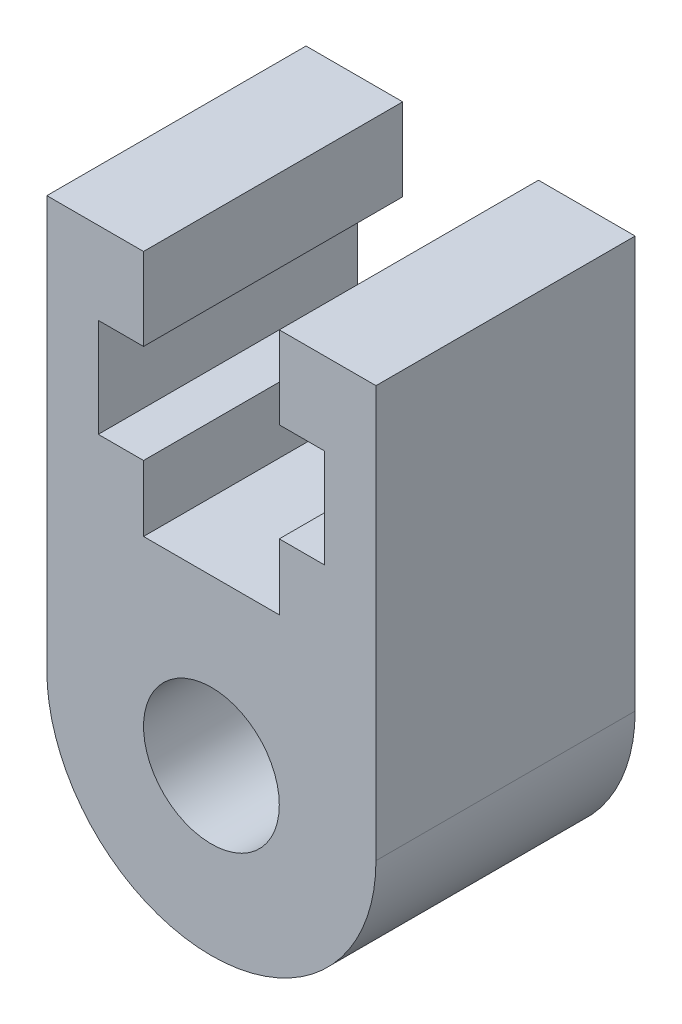
from build123d import *

# Parameters (mm, degrees)
SKETCH1_R           = 1.65
BOSS_EXTRUDE1_DEPTH = 6.3


with BuildPart() as part:
    # Sketch1 → Boss-Extrude1 (new body)
    with BuildSketch(Plane.XY):
        with BuildLine():
            Line((-4, 0), (-4, 10))
            Line((-4, 10), (-1.65, 10))
            Line((-1.65, 10), (-1.65, 8))
            Line((-1.65, 8), (-2.75, 8))
            Line((-2.75, 8), (-2.75, 5.6))
            Line((-2.75, 5.6), (-1.65, 5.6))
            Line((-1.65, 5.6), (-1.65, 4))
            Line((-1.65, 4), (1.65, 4))
            Line((1.65, 4), (1.65, 5.6))
            Line((1.65, 5.6), (2.75, 5.6))
            Line((2.75, 5.6), (2.75, 8))
            Line((2.75, 8), (1.65, 8))
            Line((1.65, 8), (1.65, 10))
            Line((1.65, 10), (4, 10))
            Line((4, 10), (4, 0))
            ThreePointArc((4, 0), (0, -4), (-4, 0))
        make_face()
        Circle(SKETCH1_R, mode=Mode.SUBTRACT)
    extrude(amount=BOSS_EXTRUDE1_DEPTH)


solid = part.part
